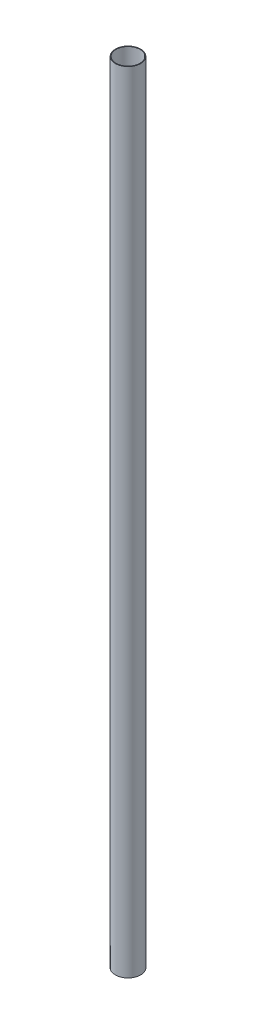
from build123d import *

# Parameters (mm, degrees)
SKETCH1_R           = 20.32
SKETCH1_R_2         = 19.304
BOSS_EXTRUDE1_DEPTH = 1270


with BuildPart() as part:
    # Sketch1 → Boss-Extrude1 (new body)
    with BuildSketch(Plane(origin=(0, 0, 0), x_dir=(1, 0, 0), z_dir=(0, 1, 0))):
        with Locations(Location((0, 0, 0), (0, 0, 90))):
            Circle(SKETCH1_R)
        with Locations(Location((0, 0, 0), (0, 0, 90))):
            Circle(SKETCH1_R_2, mode=Mode.SUBTRACT)
    extrude(amount=BOSS_EXTRUDE1_DEPTH)


solid = part.part
